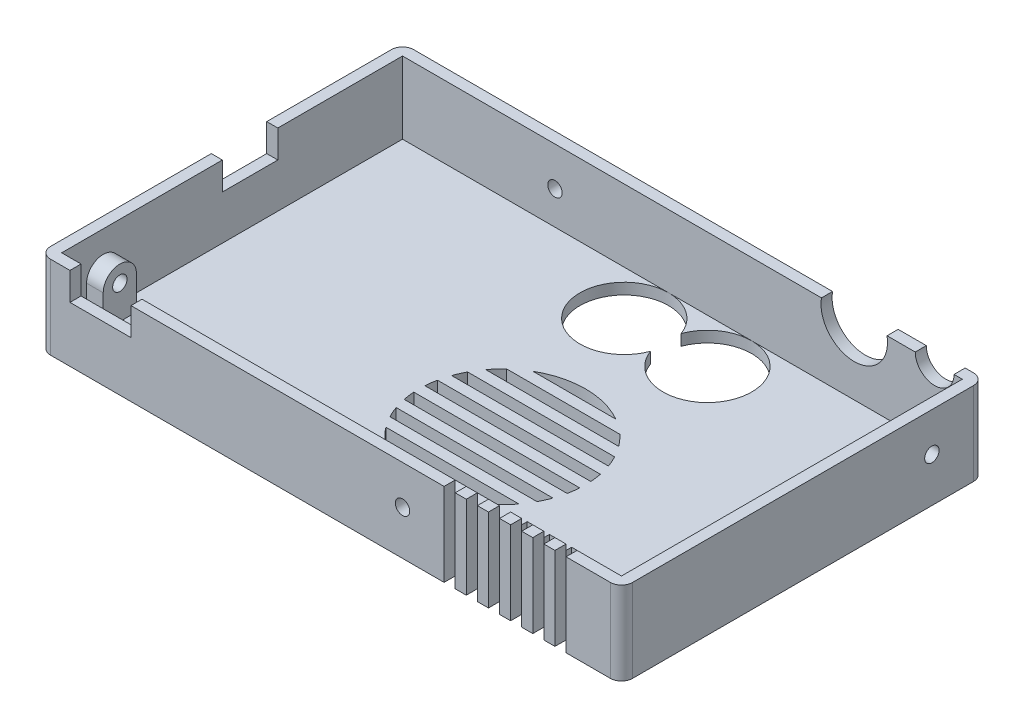
from build123d import *

# Parameters (mm, degrees)
SKETCH_1_W           = 105
SKETCH_1_H           = 65.5
EXTRUDE_1_DEPTH      = 15
SHELL_1_T            = -2
FILLET_1_R           = 2
SKETCH_2_W           = 10
SKETCH_2_H           = 5
CUT_EXTRUDE_1_DEPTH  = 14
SKETCH_3_W           = 11
SKETCH_3_H           = 5
CUT_EXTRUDE_2_DEPTH  = 14
SKETCH_5_W           = 2
SKETCH_5_H           = 17.663494354
CUT_EXTRUDE_3_DEPTH  = 15
SKETCH_6_R           = 3.5
SKETCH_6_R_2         = 6
CUT_EXTRUDE_4_DEPTH  = 15
CUT_EXTRUDE_5_DEPTH  = 15
CUT_EXTRUDE_6_DEPTH  = 15
SKETCH_9_R           = 1.75
CUT_EXTRUDE_7_DEPTH  = 15
SKETCH_10_R          = 1.3
CUT_EXTRUDE_8_DEPTH  = 15
SKETCH_12_R          = 1.3
CUT_EXTRUDE_9_DEPTH  = 15
EXTRUDE_3_DEPTH      = 3
SKETCH_16_R          = 1.3
CUT_EXTRUDE_11_DEPTH = 8
SKETCH_17_R          = 1.3
CUT_EXTRUDE_12_DEPTH = 39
SKETCH_18_R          = 1.3
CUT_EXTRUDE_13_DEPTH = 39


with BuildPart() as part:
    # 草图1 → 凸台-拉伸1 (new body)
    with BuildSketch(Plane(origin=(0, 0, 0), x_dir=(1, 0, 0), z_dir=(0, 1, 0))):
        Rectangle(SKETCH_1_W, SKETCH_1_H)
    extrude(amount=EXTRUDE_1_DEPTH)

    # 抽壳1
    shell_1_openings = [part.faces().sort_by_distance(p)[0] for p in [
        (0, 15, 0),
    ]]
    offset(amount=SHELL_1_T, openings=shell_1_openings, kind=Kind.INTERSECTION)

    # 圆角1
    fillet_1_edges = [part.edges().sort_by_distance(p)[0] for p in [
        (-52.5, 7.5, -32.75),
        (52.5, 7.5, -32.75),
        (52.5, 7.5, 32.75),
        (-52.5, 7.5, 32.75),
    ]]
    fillet(fillet_1_edges, radius=FILLET_1_R)

    # 草图2 → 切除-拉伸1 (cut)
    with BuildSketch(Plane.ZY.offset(52.5)):
        with Locations((-3.25, 12.5)):
            Rectangle(SKETCH_2_W, SKETCH_2_H)
    extrude(amount=-CUT_EXTRUDE_1_DEPTH, mode=Mode.SUBTRACT)

    # 草图3 → 切除-拉伸2 (cut)
    with BuildSketch(Plane.XY.offset(32.75)):
        with Locations((-41.5, 12.5)):
            Rectangle(SKETCH_3_W, SKETCH_3_H)
    extrude(amount=-CUT_EXTRUDE_2_DEPTH, mode=Mode.SUBTRACT)

    # 草图5 → 切除-拉伸3 (cut)
    with BuildSketch(Plane.XY.offset(32.75)):
        with Locations((41.5, 6.168252823)):
            Rectangle(SKETCH_5_W, SKETCH_5_H)
        with Locations((37.5, 6.168252823)):
            Rectangle(SKETCH_5_W, SKETCH_5_H)
        with Locations((33.5, 6.168252823)):
            Rectangle(SKETCH_5_W, SKETCH_5_H)
        with Locations((29.5, 6.168252823)):
            Rectangle(SKETCH_5_W, SKETCH_5_H)
        with Locations((25.5, 6.168252823)):
            Rectangle(SKETCH_5_W, SKETCH_5_H)
        with Locations((21.5, 6.168252823)):
            Rectangle(SKETCH_5_W, SKETCH_5_H)
    extrude(amount=-CUT_EXTRUDE_3_DEPTH, mode=Mode.SUBTRACT)

    # 草图6 → 切除-拉伸4 (cut)
    with BuildSketch(Plane(origin=(0, 0, -32.75), x_dir=(-1, 0, 0), z_dir=(0, 0, -1))):
        with Locations((-45.5, 15)):
            Circle(SKETCH_6_R)
        with Locations((-31, 14)):
            Circle(SKETCH_6_R_2)
    extrude(amount=-CUT_EXTRUDE_4_DEPTH, mode=Mode.SUBTRACT)

    # 草图7 → 切除-拉伸5 (cut)
    with BuildSketch(Plane(origin=(0, 2, 0), x_dir=(1, 0, 0), z_dir=(0, 1, 0))):
        with BuildLine():
            ThreePointArc((5, 19.966117819), (20.5, 22.75), (5, 25.533882181))
            ThreePointArc((5, 25.533882181), (-10.5, 22.75), (5, 19.966117819))
        make_face()
    extrude(amount=-CUT_EXTRUDE_5_DEPTH, mode=Mode.SUBTRACT)

    # 草图8 → 切除-拉伸6 (cut)
    with BuildSketch(Plane.XZ):
        with BuildLine():
            Line((-2.483314774, 19.75), (12.483314774, 19.75))
            ThreePointArc((12.483314774, 19.75), (5, 21.75), (-2.483314774, 19.75))
        make_face()
        with BuildLine():
            Line((-5.198039027, 17.75), (15.198039027, 17.75))
            ThreePointArc((15.198039027, 17.75), (16.143977484, 16.790506254), (17, 15.75))
            Line((17, 15.75), (-7, 15.75))
            ThreePointArc((-7, 15.75), (-6.143977484, 16.790506254), (-5.198039027, 17.75))
        make_face()
        with BuildLine():
            Line((-8.266499161, 13.75), (18.266499161, 13.75))
            ThreePointArc((18.266499161, 13.75), (18.740753807, 12.765952527), (19.142135624, 11.75))
            Line((19.142135624, 11.75), (-9.142135624, 11.75))
            ThreePointArc((-9.142135624, 11.75), (-8.740753807, 12.765952527), (-8.266499161, 13.75))
        make_face()
        with BuildLine():
            Line((-9.696938457, 9.75), (19.696938457, 9.75))
            ThreePointArc((19.696938457, 9.75), (19.865457163, 8.754540676), (19.966629547, 7.75))
            Line((19.966629547, 7.75), (-9.966629547, 7.75))
            ThreePointArc((-9.966629547, 7.75), (-9.865457163, 8.754540676), (-9.696938457, 9.75))
        make_face()
        with BuildLine():
            Line((-9.966629547, 5.75), (19.966629547, 5.75))
            ThreePointArc((19.966629547, 5.75), (19.865457163, 4.745459324), (19.696938457, 3.75))
            Line((19.696938457, 3.75), (-9.696938457, 3.75))
            ThreePointArc((-9.696938457, 3.75), (-9.865457163, 4.745459324), (-9.966629547, 5.75))
        make_face()
        with BuildLine():
            Line((-9.142135624, 1.75), (19.142135624, 1.75))
            ThreePointArc((19.142135624, 1.75), (18.740753807, 0.734047473), (18.266499161, -0.25))
            Line((18.266499161, -0.25), (-8.266499161, -0.25))
            ThreePointArc((-8.266499161, -0.25), (-8.740753807, 0.734047473), (-9.142135624, 1.75))
        make_face()
        with BuildLine():
            Line((-7, -2.25), (17, -2.25))
            ThreePointArc((17, -2.25), (16.143977484, -3.290506254), (15.198039027, -4.25))
            Line((15.198039027, -4.25), (-5.198039027, -4.25))
            ThreePointArc((-5.198039027, -4.25), (-6.143977484, -3.290506254), (-7, -2.25))
        make_face()
        with BuildLine():
            Line((-2.483314774, -6.25), (12.483314774, -6.25))
            ThreePointArc((12.483314774, -6.25), (5, -8.25), (-2.483314774, -6.25))
        make_face()
    extrude(amount=-CUT_EXTRUDE_6_DEPTH, mode=Mode.SUBTRACT)

    # 草图9 → 切除-拉伸7 (cut)
    with BuildSketch(Plane(origin=(0, 2, 0), x_dir=(1, 0, 0), z_dir=(0, 1, 0))):
        with Locations(Location((-43, -26.75, 0), (0, 0, 270))):
            Circle(SKETCH_9_R)
        with Locations(Location((-38, -26.75, 0), (0, 0, 270))):
            Circle(SKETCH_9_R)
    extrude(amount=-CUT_EXTRUDE_7_DEPTH, mode=Mode.SUBTRACT)

    # 草图10 → 切除-拉伸8 (cut)
    with BuildSketch(Plane.ZY.offset(52.5)):
        with Locations((23.25, 8)):
            Circle(SKETCH_10_R)
    extrude(amount=-CUT_EXTRUDE_8_DEPTH, mode=Mode.SUBTRACT)

    # 草图12 → 切除-拉伸9 (cut)
    with BuildSketch(Plane(origin=(52.5, 0, 0), x_dir=(0, 0, -1), z_dir=(1, 0, 0))):
        with Locations((23.25, 8)):
            Circle(SKETCH_12_R)
    extrude(amount=-CUT_EXTRUDE_9_DEPTH, mode=Mode.SUBTRACT)

    # 草图13 → 凸台-拉伸3 (add)
    with BuildSketch(Plane(origin=(-50.5, 0, 0), x_dir=(0, 0, -1), z_dir=(1, 0, 0))):
        with BuildLine():
            Line((-26.25, 8), (-26.25, 2))
            Line((-26.25, 2), (-20.25, 2))
            Line((-20.25, 2), (-20.25, 8))
            ThreePointArc((-20.25, 8), (-23.25, 11), (-26.25, 8))
        make_face()
    extrude(amount=EXTRUDE_3_DEPTH)

    # 草图16 → 切除-拉伸11 (cut)
    with BuildSketch(Plane.ZY.offset(50.5)):
        with Locations((23.25, 8)):
            Circle(SKETCH_16_R)
    extrude(amount=-CUT_EXTRUDE_11_DEPTH, mode=Mode.SUBTRACT)

    # 草图17 → 切除-拉伸12 (cut)
    with BuildSketch(Plane.XY.offset(32.75)):
        with Locations((13, 8)):
            Circle(SKETCH_17_R)
    extrude(amount=-CUT_EXTRUDE_12_DEPTH, mode=Mode.SUBTRACT)

    # 草图18 → 切除-拉伸13 (cut)
    with BuildSketch(Plane(origin=(0, 0, -32.75), x_dir=(-1, 0, 0), z_dir=(0, 0, -1))):
        with Locations((23, 8)):
            Circle(SKETCH_18_R)
    extrude(amount=-CUT_EXTRUDE_13_DEPTH, mode=Mode.SUBTRACT)


solid = part.part
